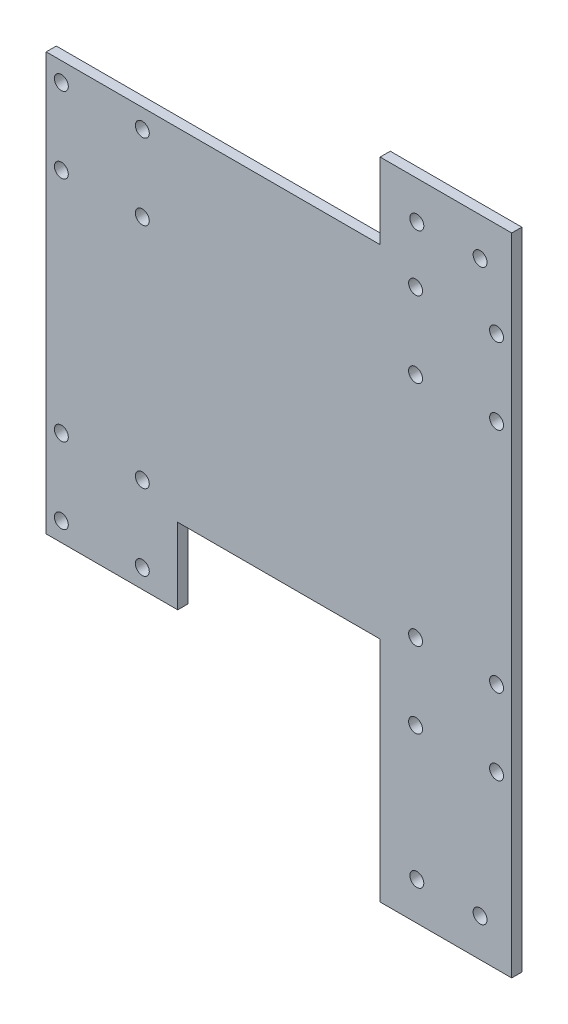
from build123d import *

# Parameters (mm, degrees)
SKETCH1_W            = 184
SKETCH1_H            = 165
BOSS_EXTRUDE1_DEPTH  = 4
M5_CLEARANCE_HOLE1_D = 5.5
SKETCH4_W            = 80
SKETCH4_H            = 30
CUT_EXTRUDE1_DEPTH   = 10
SKETCH5_W            = 52
SKETCH5_H            = 60
SKETCH5_H_2          = 30
BOSS_EXTRUDE2_DEPTH  = 4
M5_CLEARANCE_HOLE2_D = 5.5


with BuildPart() as part:
    # Sketch1 → Boss-Extrude1 (new body)
    with BuildSketch(Plane.XY):
        with Locations((70, 60)):
            Rectangle(SKETCH1_W, SKETCH1_H)
    extrude(amount=BOSS_EXTRUDE1_DEPTH)

    # M5 Clearance Hole1 (through all)
    with Locations(Plane(origin=(0, 0, 0), x_dir=(-1, 0, 0), z_dir=(0, 0, -1))):
        with Locations((-16, -15), (-16, 15), (16, 15), (16, -15), (16, 105), (-16, 105), (-16, 135), (16, 135), (-124, 135), (-124, 105), (-156, 105), (-156, 135), (-156, 15), (-124, 15), (-124, -15), (-156, -15)):
            Hole(M5_CLEARANCE_HOLE1_D / 2)

    # Sketch4 → Cut-Extrude1 (cut)
    with BuildSketch(Plane.XY.offset(4)):
        with Locations((70, -7.5)):
            Rectangle(SKETCH4_W, SKETCH4_H)
    extrude(amount=-CUT_EXTRUDE1_DEPTH, mode=Mode.SUBTRACT)

    # Sketch5 → Boss-Extrude2 (add)
    with BuildSketch(Plane.XY.offset(4)):
        with Locations((136, -52.5)):
            Rectangle(SKETCH5_W, SKETCH5_H)
        with Locations((136, 157.5)):
            Rectangle(SKETCH5_W, SKETCH5_H_2)
    extrude(amount=-BOSS_EXTRUDE2_DEPTH)

    # M5 Clearance Hole2 (through all)
    with Locations(Plane.XY.offset(4)):
        with Locations((149.5, -67.5), (124.5, -67.5), (124.5, 157.5), (149.5, 157.5)):
            Hole(M5_CLEARANCE_HOLE2_D / 2)


solid = part.part
